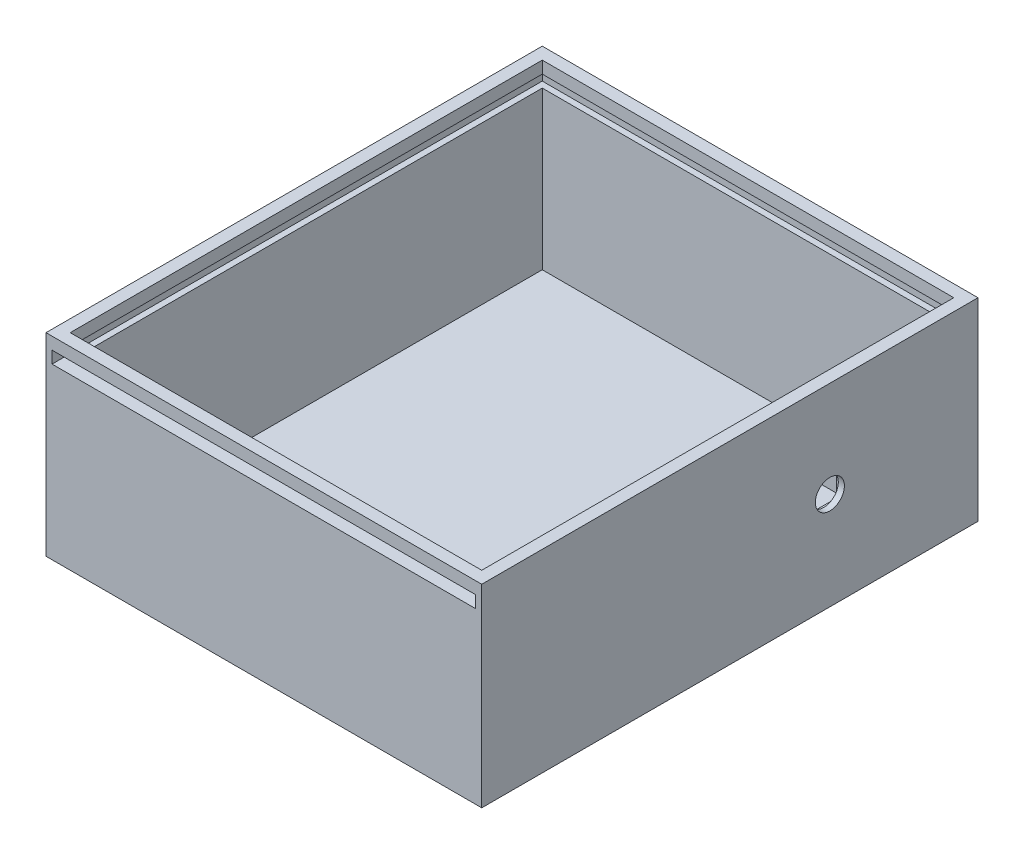
from build123d import *

# Parameters (mm, degrees)
SKETCH1_W           = 114.3
SKETCH1_H           = 130.175
BOSS_EXTRUDE1_DEPTH = 50.8
SHELL1_T            = -3.175
SKETCH2_R           = 3.81
CUT_EXTRUDE1_DEPTH  = 2.54
CUT_EXTRUDE3_START  = -3.175
SKETCH5_W           = 9.887367338
SKETCH5_H           = 9.869187764
CUT_EXTRUDE3_DEPTH  = 1.5875
SKETCH6_W           = 29.3243
SKETCH6_H           = 6.35
BOSS_EXTRUDE2_DEPTH = 6.35
CUT_EXTRUDE4_START  = -3.175
CUT_EXTRUDE4_DEPTH  = 3.175
CUT_EXTRUDE5_DEPTH  = 0.508


with BuildPart() as part:
    # Sketch1 → Boss-Extrude1 (new body)
    with BuildSketch(Plane(origin=(0, 0, 0), x_dir=(1, 0, 0), z_dir=(0, 1, 0))):
        Rectangle(SKETCH1_W, SKETCH1_H)
    extrude(amount=BOSS_EXTRUDE1_DEPTH)

    # Shell1
    shell1_openings = [part.faces().sort_by_distance(p)[0] for p in [
        (0, 50.8, 0),
    ]]
    offset(amount=SHELL1_T, openings=shell1_openings, kind=Kind.INTERSECTION)

    # Sketch2 → Cut-Extrude1 (cut)
    with BuildSketch(Plane(origin=(57.15, 0, 0), x_dir=(0, 0, -1), z_dir=(1, 0, 0))):
        with Locations((26.2255, 25.6032)):
            Circle(SKETCH2_R)
    extrude(amount=-CUT_EXTRUDE1_DEPTH, mode=Mode.SUBTRACT)

    # Sketch5 → Cut-Extrude3 (cut)
    with BuildSketch(Plane(origin=(57.15, 0, 0), x_dir=(0, 0, -1), z_dir=(1, 0, 0)).offset(CUT_EXTRUDE3_START)):
        with Locations((26.2255, 25.6032)):
            Rectangle(SKETCH5_W, SKETCH5_H)
    extrude(amount=CUT_EXTRUDE3_DEPTH, mode=Mode.SUBTRACT)

    # Sketch6 → Boss-Extrude2 (add)
    with BuildSketch(Plane(origin=(0, 3.175, 0), x_dir=(1, 0, 0), z_dir=(0, 1, 0))):
        with Locations((39.31285, -26.236270706)):
            Rectangle(SKETCH6_W, SKETCH6_H)
        with Locations((39.31285, 52.933973936)):
            Rectangle(SKETCH6_W, SKETCH6_H)
    extrude(amount=BOSS_EXTRUDE2_DEPTH)

    # Sketch7 → Cut-Extrude4 (cut)
    with BuildSketch(Plane(origin=(0, 50.8, 0), x_dir=(1, 0, 0), z_dir=(0, 1, 0)).offset(CUT_EXTRUDE4_START)):
        Polygon((0, 63.5), (-55.5625, 63.5), (-55.5625, -65.0875), (55.5625, -65.0875), (55.5625, 63.5), align=None)
    extrude(amount=-CUT_EXTRUDE4_DEPTH, mode=Mode.SUBTRACT)

    # Sketch8 → Cut-Extrude5 (cut)
    # profile 1 of 5: a face of its own
    with BuildSketch(Plane(origin=(0, 0, 0), x_dir=(-1, 0, 0), z_dir=(0, -1, 0))):
        with BuildLine():
            Line((-6.35, -39.199038462), (-6.35, -35.463070913))
            add(Edge.make_bspline(
                [(-6.35, -35.463070913), (-6.349717536, -35.206108696), (-6.349176323, -34.713757675), (-6.332767492, -34.007737157), (-6.310850782, -33.366515618), (-6.280469335, -32.791475688), (-6.244565037, -32.280848068), (-6.194207508, -31.836943338), (-6.141627899, -31.456272324), (-6.088171387, -31.228181506), (-6.063792067, -31.124158654)],
                knots=[0, 0, 0, 0, 1.415646017, 2.712440637, 3.8905458, 4.950247383, 5.884950622, 6.709939814, 7.411656543, 8, 8, 8, 8], degree=3))
            add(Edge.make_bspline(
                [(-6.063792067, -31.124158654), (-6.02774833, -30.992477854), (-5.956510181, -30.732219148), (-5.813853035, -30.357183995), (-5.644601499, -30.000445471), (-5.452074093, -29.660411352), (-5.226793729, -29.343274821), (-4.983747353, -29.038463956), (-4.707228276, -28.756738561), (-4.405957994, -28.494282702), (-4.083757547, -28.251702031), (-3.734772965, -28.047890406), (-3.369423334, -27.869683868), (-2.982743252, -27.723777133), (-2.574357303, -27.615274822), (-2.147167734, -27.534722788), (-1.700694191, -27.483359837), (-1.395564235, -27.478457254), (-1.240234375, -27.475961538)],
                knots=[0, 0, 0, 0, 0.999549623, 1.97554611, 2.93413192, 3.889860808, 4.833293765, 5.780583482, 6.742559327, 7.719844669, 8.705620613, 9.691528643, 10.674968152, 11.680406189, 12.713313868, 13.765869198, 14.862690416, 16, 16, 16, 16], degree=3))
            add(Edge.make_bspline(
                [(-1.240234375, -27.475961538), (-1.083601047, -27.478255293), (-0.777137362, -27.482743179), (-0.328794043, -27.536607246), (0.099658909, -27.609161575), (0.507271489, -27.720724102), (0.89162304, -27.866841266), (1.258587174, -28.038248011), (1.601920817, -28.24498694), (1.922870414, -28.482539514), (2.221737222, -28.746798906), (2.496355461, -29.036647041), (2.745117646, -29.350913761), (2.968581459, -29.68860031), (3.161564923, -30.052998773), (3.334415397, -30.438582495), (3.47958217, -30.848702958), (3.55594579, -31.132507213), (3.594771635, -31.276802885)],
                knots=[0, 0, 0, 0, 1.121902311, 2.195077645, 3.232258892, 4.234102512, 5.217864754, 6.176164875, 7.132989551, 8.084763148, 9.034132444, 9.988522005, 10.94243251, 11.903244335, 12.886203696, 13.894208494, 14.929344452, 16, 16, 16, 16], degree=3))
            add(Edge.make_bspline(
                [(3.594771635, -31.276802885), (3.62013266, -31.39615159), (3.67571282, -31.657711217), (3.738183365, -32.088446738), (3.789416037, -32.590205354), (3.837226777, -33.161279859), (3.862560492, -33.803001986), (3.892306405, -34.513899932), (3.906341876, -35.296379615), (3.907229093, -35.842134798), (3.907692308, -36.127073317)],
                knots=[0, 0, 0, 0, 0.601372724, 1.317943291, 2.144091499, 3.08771165, 4.142394186, 5.309582461, 6.595334295, 8, 8, 8, 8], degree=3))
            Line((3.907692308, -36.127073317), (3.907692308, -37.489423077))
            Line((3.907692308, -37.489423077), (12.7, -37.489423077))
            Line((12.7, -37.489423077), (12.7, -39.199038462))
            Line((12.7, -39.199038462), (-6.35, -39.199038462))
        make_face()
        with BuildLine():
            Line((-4.396153846, -37.489423077), (1.953846154, -37.489423077))
            Line((1.953846154, -37.489423077), (1.995823317, -34.154146635))
            add(Edge.make_bspline(
                [(1.995823317, -34.154146635), (1.995912991, -33.991295614), (1.996086104, -33.676915076), (1.974321435, -33.222798863), (1.94953139, -32.801419484), (1.912037888, -32.4143615), (1.862889843, -32.0602668), (1.801769334, -31.742193898), (1.735321618, -31.455385498), (1.624303969, -31.125467994), (1.453602941, -30.75462985), (1.205109514, -30.349517484), (0.883198148, -30.008848113), (0.522267447, -29.71459005), (0.121828253, -29.476481128), (-0.308871447, -29.308504783), (-0.76345088, -29.205071883), (-1.074320567, -29.192154105), (-1.232602163, -29.185576923)],
                knots=[0, 0, 0, 0, 1.160746174, 2.240796558, 3.240300023, 4.169675897, 5.012224395, 5.787635701, 6.478238024, 7.109103438, 8.265591281, 9.382545711, 10.479929969, 11.588830844, 12.694575677, 13.785760505, 14.872603606, 16, 16, 16, 16], degree=3))
            add(Edge.make_bspline(
                [(-1.232602163, -29.185576923), (-1.385755923, -29.192449396), (-1.690206641, -29.206111021), (-2.136407532, -29.307651214), (-2.562224872, -29.478284882), (-2.959439272, -29.714798217), (-3.319575779, -30.001915094), (-3.632957799, -30.335361555), (-3.883200877, -30.715990661), (-4.050939545, -31.067112005), (-4.149144612, -31.381536849), (-4.220074555, -31.653297671), (-4.268985639, -31.961714422), (-4.315787447, -32.303856674), (-4.353565845, -32.679290027), (-4.379800608, -33.090400647), (-4.394993323, -33.535819495), (-4.39575764, -33.845029864), (-4.396153846, -34.00531851)],
                knots=[0, 0, 0, 0, 1.120540835, 2.227496496, 3.330685923, 4.466139262, 5.598993257, 6.692710361, 7.80064471, 8.921224235, 9.527843361, 10.209888745, 10.975318552, 11.811557897, 12.738105936, 13.73658638, 14.826690375, 16, 16, 16, 16], degree=3))
            Line((-4.396153846, -34.00531851), (-4.396153846, -37.489423077))
        make_face(mode=Mode.SUBTRACT)
    # profile 2 of 5: a face of its own
    with BuildSketch(Plane(origin=(0, 0, 0), x_dir=(-1, 0, 0), z_dir=(0, -1, 0))):
        Polygon((-6.35, -15.752884615), (12.7, -6.960576923), (12.7, -8.819020433), (6.594230769, -11.63530649), (6.594230769, -20.271153846), (12.7, -23.167578125), (12.7, -25.033653846), (-6.35, -15.997115385), align=None)
        Polygon((-2.636929087, -15.894080529), (4.640384615, -19.343840144), (4.640384615, -12.535907452), align=None, mode=Mode.SUBTRACT)
    # profile 3 of 5: a face of its own
    with BuildSketch(Plane(origin=(0, 0, 0), x_dir=(-1, 0, 0), z_dir=(0, -1, 0))):
        with BuildLine():
            Line((-6.35, -4.029807692), (-6.35, -0.217518029))
            add(Edge.make_bspline(
                [(-6.35, -0.217518029), (-6.349153168, 0.036887256), (-6.347527156, 0.525373585), (-6.338460646, 1.225179528), (-6.31247451, 1.861052728), (-6.290112077, 2.43266071), (-6.249334511, 2.939992989), (-6.210360132, 3.384605243), (-6.159340635, 3.764449711), (-6.111958262, 3.994387845), (-6.090504808, 4.098497596)],
                knots=[0, 0, 0, 0, 1.410062039, 2.707475311, 3.878576406, 4.937260626, 5.877586885, 6.699081471, 7.410979367, 8, 8, 8, 8], degree=3))
            add(Edge.make_bspline(
                [(-6.090504808, 4.098497596), (-6.056069035, 4.237870685), (-5.987932098, 4.513643656), (-5.843917616, 4.910702016), (-5.67725441, 5.289052751), (-5.481527115, 5.647158514), (-5.255174324, 5.983099073), (-5.002506617, 6.30081137), (-4.724034326, 6.599264097), (-4.417247118, 6.874562209), (-4.088681537, 7.124629555), (-3.739239346, 7.343977134), (-3.370365414, 7.529321805), (-2.981485194, 7.674769799), (-2.576894453, 7.796816648), (-2.152463733, 7.878817095), (-1.709609917, 7.929895362), (-1.408286111, 7.934941392), (-1.255498798, 7.9375)],
                knots=[0, 0, 0, 0, 1.02737844, 2.032840108, 3.019645024, 3.985760442, 4.950801802, 5.916702504, 6.889791722, 7.870143693, 8.864820395, 9.842884691, 10.820524757, 11.815201459, 12.812418953, 13.84314332, 14.906358105, 16, 16, 16, 16], degree=3))
            add(Edge.make_bspline(
                [(-1.255498798, 7.9375), (-1.001670586, 7.929504453), (-0.506386001, 7.91390307), (0.212402511, 7.768442149), (0.882904352, 7.530172806), (1.504275281, 7.201841761), (2.064403223, 6.783724329), (2.556385558, 6.281213681), (2.968082796, 5.694029481), (3.253575919, 5.147407061), (3.436417322, 4.664548346), (3.565066646, 4.267038458), (3.664463915, 3.83342248), (3.753509775, 3.367854987), (3.820738283, 2.86839852), (3.869977604, 2.336250162), (3.900751783, 1.771030394), (3.905334696, 1.382742031), (3.907692308, 1.182992788)],
                knots=[0, 0, 0, 0, 1.260483769, 2.459530307, 3.627416485, 4.787058657, 5.939039949, 7.08810263, 8.267026773, 9.491475466, 10.141966685, 10.831826277, 11.566392101, 12.351337768, 13.187381173, 14.07005841, 15.007169909, 16, 16, 16, 16], degree=3))
            Line((3.907692308, 1.182992788), (12.7, 8.181730769))
            Line((12.7, 8.181730769), (12.7, 6.067608173))
            Line((12.7, 6.067608173), (3.907692308, -0.931129808))
            Line((3.907692308, -0.931129808), (3.907692308, -2.320192308))
            Line((3.907692308, -2.320192308), (12.7, -2.320192308))
            Line((12.7, -2.320192308), (12.7, -4.029807692))
            Line((12.7, -4.029807692), (-6.35, -4.029807692))
        make_face()
        with BuildLine():
            Line((-4.396153846, -2.320192308), (1.953846154, -2.320192308))
            Line((1.953846154, -2.320192308), (1.980558894, 1.167728365))
            add(Edge.make_bspline(
                [(1.980558894, 1.167728365), (1.980630981, 1.330578884), (1.980770707, 1.646229572), (1.959032586, 2.102888618), (1.934305883, 2.528086203), (1.89647515, 2.920190464), (1.847749686, 3.279394781), (1.786704445, 3.605459985), (1.715888772, 3.899112869), (1.605146902, 4.240487898), (1.437358701, 4.626192593), (1.176753478, 5.03620495), (0.863617132, 5.395957897), (0.495209692, 5.688949953), (0.096581614, 5.934429562), (-0.336349796, 6.099627575), (-0.789540664, 6.209725038), (-1.100918085, 6.221761633), (-1.259314904, 6.227884615)],
                knots=[0, 0, 0, 0, 1.146477201, 2.22219935, 3.21835465, 4.145220026, 4.995151787, 5.769831222, 6.480173269, 7.120302478, 8.295254187, 9.430763426, 10.528629691, 11.636497428, 12.733230534, 13.811001502, 14.886462612, 16, 16, 16, 16], degree=3))
            add(Edge.make_bspline(
                [(-1.259314904, 6.227884615), (-1.412500192, 6.221322758), (-1.716057537, 6.20831955), (-2.160682127, 6.102739539), (-2.580449006, 5.922239951), (-2.975900155, 5.684791943), (-3.329257543, 5.38679368), (-3.634878049, 5.04408673), (-3.885070511, 4.656737045), (-4.051357483, 4.297894848), (-4.149010488, 3.974585208), (-4.219987752, 3.695208602), (-4.26924862, 3.377987581), (-4.315907642, 3.024364769), (-4.353679381, 2.633665297), (-4.379733812, 2.204744061), (-4.394992459, 1.740258089), (-4.395757708, 1.418331246), (-4.396153846, 1.251682692)],
                knots=[0, 0, 0, 0, 1.100823979, 2.181431445, 3.263702604, 4.376021382, 5.48638238, 6.575013887, 7.666064109, 8.791843368, 9.405226397, 10.093019944, 10.863016055, 11.711746407, 12.658404307, 13.684961631, 14.801597923, 16, 16, 16, 16], degree=3))
            Line((-4.396153846, 1.251682692), (-4.396153846, -2.320192308))
        make_face(mode=Mode.SUBTRACT)
    # profile 4 of 5: a face of its own
    with BuildSketch(Plane(origin=(0, 0, 0), x_dir=(-1, 0, 0), z_dir=(0, -1, 0))):
        Polygon((-6.35, 12.089423077), (-6.35, 13.799038462), (0.904417067, 13.799038462), (-6.35, 21.740354567), (-6.35, 24.178846154), (2.198076923, 14.817938702), (12.7, 24.911538462), (12.7, 22.633323317), (3.507001202, 13.799038462), (12.7, 13.799038462), (12.7, 12.089423077), align=None)
    # profile 5 of 5: a face of its own
    with BuildSketch(Plane(origin=(0, 0, 0), x_dir=(-1, 0, 0), z_dir=(0, -1, 0))):
        Polygon((-6.35, 26.254807692), (-6.35, 28.212469952), (1.835546875, 33.219200721), (-6.35, 38.218299279), (-6.35, 40.175961538), (3.64438101, 34.070192308), (12.7, 34.070192308), (12.7, 32.360576923), (3.64438101, 32.360576923), align=None)
    extrude(amount=-CUT_EXTRUDE5_DEPTH, mode=Mode.SUBTRACT)


solid = part.part
